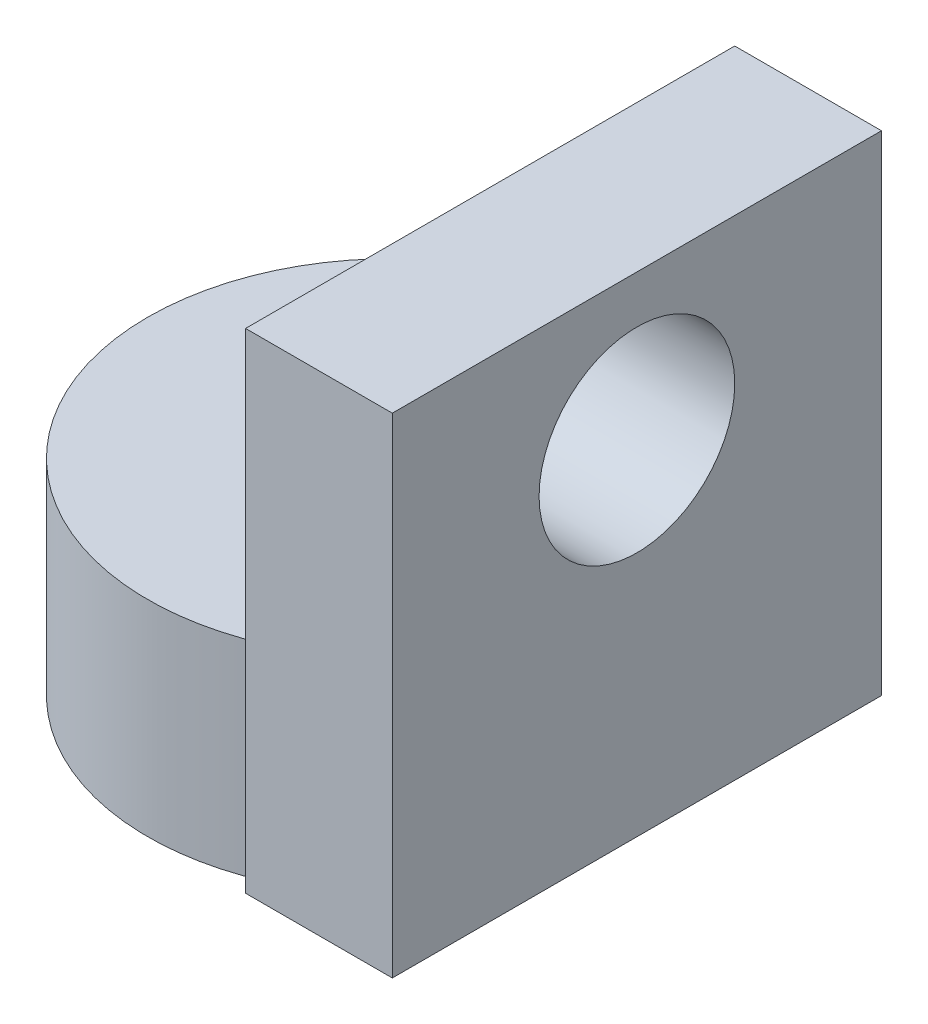
from build123d import *

# Parameters (mm, degrees)
SKETCH1_R           = 2.5
SKETCH1_R_2         = 1
BOSS_EXTRUDE2_DEPTH = 2.1
SKETCH2_W           = 5
SKETCH2_H           = 5
SKETCH2_R           = 1
BOSS_EXTRUDE3_DEPTH = 1.5


with BuildPart() as part:
    # Sketch1 → Boss-Extrude2 (new body)
    with BuildSketch(Plane(origin=(0, 0, 0), x_dir=(1, 0, 0), z_dir=(0, 1, 0))):
        with Locations(Location((0, 0, 0), (0, 0, 270))):
            Circle(SKETCH1_R)
        with Locations(Location((0, 0, 0), (0, 0, 270))):
            Circle(SKETCH1_R_2, mode=Mode.SUBTRACT)
    extrude(amount=BOSS_EXTRUDE2_DEPTH)

    # Sketch2 → Boss-Extrude3 (add)
    with BuildSketch(Plane(origin=(2.5, 0, 0), x_dir=(0, 0, -1), z_dir=(1, 0, 0))):
        with Locations((0, 2.5)):
            Rectangle(SKETCH2_W, SKETCH2_H)
        with Locations((0, 3.513067933)):
            Circle(SKETCH2_R, mode=Mode.SUBTRACT)
    extrude(amount=-BOSS_EXTRUDE3_DEPTH)


solid = part.part
